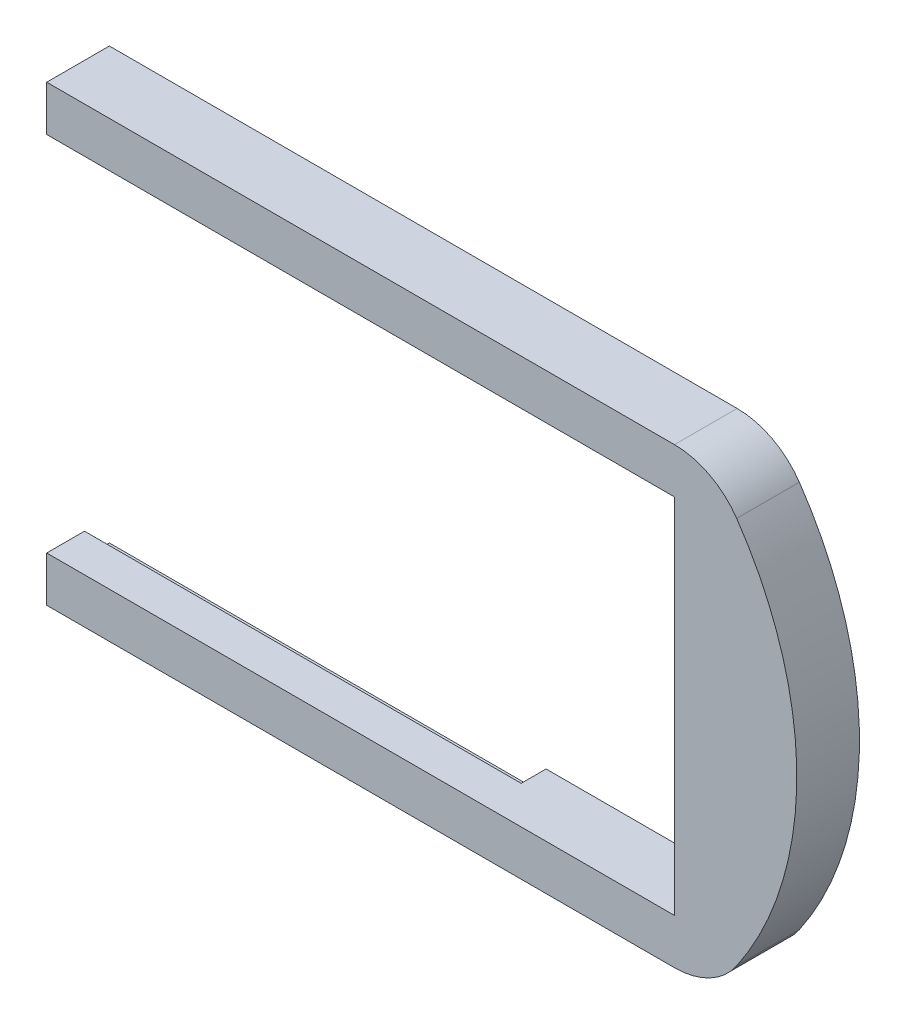
from build123d import *

# Parameters (mm, degrees)
EXTRUDE_1_DEPTH = 3.3
SKETCH_2_W      = 57.839960125
SKETCH_2_H      = 3
EXTRUDE_2_DEPTH = 5


with BuildPart() as part:
    # 草图1 → 凸台-拉伸1 (new body)
    with BuildSketch(Plane.XY):
        with BuildLine():
            Line((-49.172249904, -26.54104015), (-49.172249904, -29.54104015))
            Line((-49.172249904, -29.54104015), (33.967710221, -29.54104015))
            ThreePointArc((33.967710221, -29.54104015), (38.626676103, -28.38943192), (42.212581294, -25.199847532))
            ThreePointArc((42.212581294, -25.199847532), (50.170886291, 0.45895985), (42.212581294, 26.117767232))
            ThreePointArc((42.212581294, 26.117767232), (38.626676103, 29.307351619), (33.967710221, 30.45895985))
            Line((33.967710221, 30.45895985), (-49.172249904, 30.45895985))
            Line((-49.172249904, 30.45895985), (-49.172249904, 27.45895985))
            Line((-49.172249904, 27.45895985), (8.667710221, 27.45895985))
            Line((8.667710221, 27.45895985), (8.667710221, 24.420125017))
            Line((8.667710221, 24.420125017), (39.739119972, 24.420125017))
            Line((39.739119972, 24.420125017), (39.739119972, -23.502205318))
            ThreePointArc((39.739119972, -23.502205318), (39.72572916, -23.521645368), (39.712272868, -23.54104015))
            Line((39.712272868, -23.54104015), (8.667710221, -23.54104015))
            Line((8.667710221, -23.54104015), (8.667710221, -26.54104015))
            Line((8.667710221, -26.54104015), (-49.172249904, -26.54104015))
        make_face()
    extrude(amount=EXTRUDE_1_DEPTH)

    # 草图2 → 凸台-拉伸2 (add)
    with BuildSketch(Plane.XY.offset(3.3)):
        with Locations((-20.252269842, -25.04104015)):
            Rectangle(SKETCH_2_W, SKETCH_2_H)
        with BuildLine():
            Line((39.739119972, 24.420125017), (33.967710221, 24.420125017))
            Line((33.967710221, 24.420125017), (33.967710221, -23.54104015))
            Line((33.967710221, -23.54104015), (39.712272868, -23.54104015))
            ThreePointArc((39.712272868, -23.54104015), (39.72572916, -23.521645368), (39.739119972, -23.502205318))
            Line((39.739119972, -23.502205318), (39.739119972, 24.420125017))
        make_face()
        with BuildLine():
            Line((-49.172249904, 30.45895985), (-49.172249904, 27.45895985))
            Line((-49.172249904, 27.45895985), (8.667710221, 27.45895985))
            Line((8.667710221, 27.45895985), (8.667710221, 24.45895985))
            Line((8.667710221, 24.45895985), (33.967710221, 24.45895985))
            Line((33.967710221, 24.45895985), (33.967710221, 24.420125017))
            Line((33.967710221, 24.420125017), (39.739119972, 24.420125017))
            Line((39.739119972, 24.420125017), (39.739119972, -23.502205318))
            ThreePointArc((39.739119972, -23.502205318), (39.72572916, -23.521645368), (39.712272868, -23.54104015))
            Line((39.712272868, -23.54104015), (33.967710221, -23.54104015))
            Line((33.967710221, -23.54104015), (8.667710221, -23.54104015))
            Line((8.667710221, -23.54104015), (8.667710221, -26.54104015))
            Line((8.667710221, -26.54104015), (-49.172249904, -26.54104015))
            Line((-49.172249904, -26.54104015), (-49.172249904, -29.54104015))
            Line((-49.172249904, -29.54104015), (33.967710221, -29.54104015))
            ThreePointArc((33.967710221, -29.54104015), (38.626676103, -28.38943192), (42.212581294, -25.199847532))
            ThreePointArc((42.212581294, -25.199847532), (50.170886291, 0.45895985), (42.212581294, 26.117767232))
            ThreePointArc((42.212581294, 26.117767232), (38.626676103, 29.307351619), (33.967710221, 30.45895985))
            Line((33.967710221, 30.45895985), (-49.172249904, 30.45895985))
        make_face()
        with Locations((-20.252269842, 25.95895985)):
            Rectangle(SKETCH_2_W, SKETCH_2_H)
    extrude(amount=EXTRUDE_2_DEPTH)


solid = part.part
